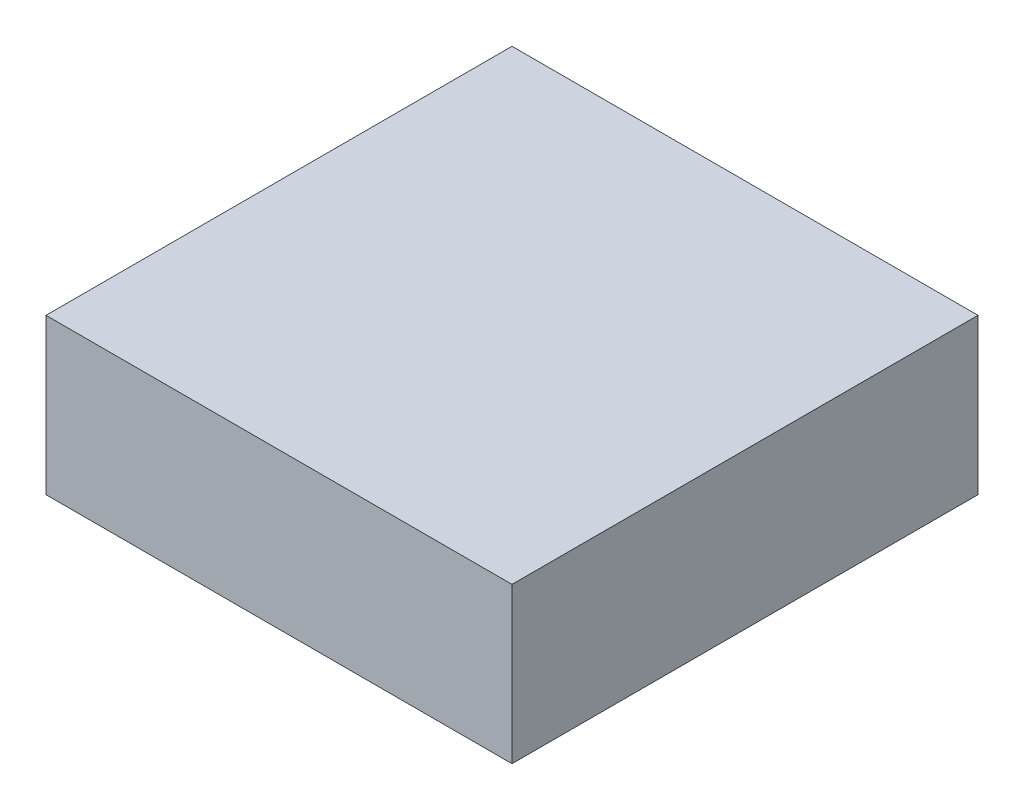
from build123d import *

# Parameters (mm, degrees)
SKETCH_1_W          = 36
SKETCH_1_H          = 12
LOWER_SUPPORT_DEPTH = 36


with BuildPart() as part:
    # 草图1 → Lower_support (new body)
    with BuildSketch(Plane.XY):
        with Locations((18, 6)):
            Rectangle(SKETCH_1_W, SKETCH_1_H)
    extrude(amount=LOWER_SUPPORT_DEPTH)


solid = part.part
